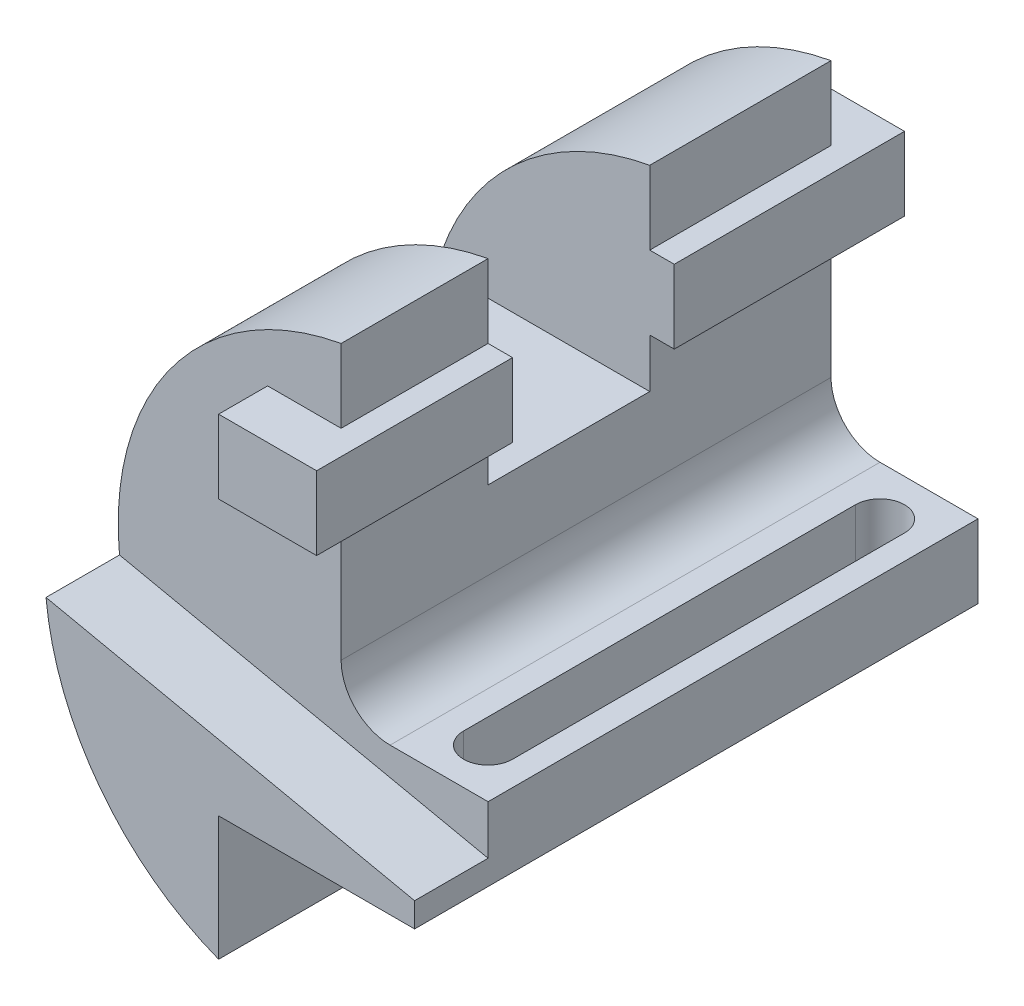
from build123d import *

# Parameters (mm, degrees)
BOSS_EXTRUDE1_DEPTH      = 115
CUT_EXTRUDE1_START       = -15
CUT_EXTRUDE1_DEPTH       = 15
BOSS_EXTRUDE2_DEPTH      = 10
BOSS_EXTRUDE2_DEPTH_BACK = 110
SKETCH3_W                = 20
SKETCH3_H                = 15
CUT_EXTRUDE2_DEPTH       = 148.83859442
CUT_EXTRUDE2_DEPTH_BACK  = 148.83859442
SKETCH4_W                = 33
SKETCH4_H                = 40
CUT_EXTRUDE3_DEPTH       = 153.581945197
CUT_EXTRUDE3_DEPTH_BACK  = 153.581945197
FILLET1_R                = 10


with BuildPart() as part:
    # Sketch1 → Boss-Extrude1 (new body)
    with BuildSketch(Plane.XY):
        with BuildLine():
            Line((0, 0), (0, 15))
            Line((0, 15), (-30, 15))
            Line((-30, 15), (-30, 81))
            ThreePointArc((-30, 81), (-75.256322222, 31.603413808), (-40, -25.362796982))
            Line((-40, -25.362796982), (-40, 0))
            Line((-40, 0), (0, 0))
        make_face()
    extrude(amount=BOSS_EXTRUDE1_DEPTH)

    # Sketch2 → Cut-Extrude1 (cut)
    with BuildSketch(Plane.XY.offset(115).offset(CUT_EXTRUDE1_START)):
        with BuildLine():
            Line((0, 5), (-75.235044142, 20.9917023))
            ThreePointArc((-75.235044142, 20.9917023), (-64.318751046, 59.816391467), (-30, 81))
            Line((-30, 81), (-30, 15))
            Line((-30, 15), (0, 15))
            Line((0, 15), (0, 5))
        make_face()
    extrude(amount=CUT_EXTRUDE1_DEPTH, mode=Mode.SUBTRACT)

    # Sketch3 → Boss-Extrude2 (add, two sides: drawn at the far end of the back side and taken through both)
    with BuildSketch(Plane(origin=(0, 0, 0), x_dir=(-1, 0, 0), z_dir=(0, 0, -1)).offset(-BOSS_EXTRUDE2_DEPTH_BACK)):
        with Locations((35, 58.5)):
            Rectangle(SKETCH3_W, SKETCH3_H)
    extrude(amount=BOSS_EXTRUDE2_DEPTH + BOSS_EXTRUDE2_DEPTH_BACK)

    # Sketch4 → Cut-Extrude2 (cut, two sides: drawn at the far end of the back side and taken through both)
    with BuildSketch(Plane(origin=(-30, 0, 0), x_dir=(0, 0, -1), z_dir=(1, 0, 0)).offset(-CUT_EXTRUDE2_DEPTH_BACK)):
        with Locations((-53.5, 61)):
            Rectangle(SKETCH4_W, SKETCH4_H)
    extrude(amount=CUT_EXTRUDE2_DEPTH + CUT_EXTRUDE2_DEPTH_BACK, mode=Mode.SUBTRACT)

    # Sketch5 → Cut-Extrude3 (cut, two sides: drawn at the far end of the back side and taken through both)
    with BuildSketch(Plane(origin=(0, 15, 0), x_dir=(1, 0, 0), z_dir=(0, 1, 0)).offset(-CUT_EXTRUDE3_DEPTH_BACK)):
        with BuildLine():
            Line((-5, -10), (-5, -90))
            ThreePointArc((-5, -90), (-10, -95), (-15, -90))
            Line((-15, -90), (-15, -10))
            ThreePointArc((-15, -10), (-10, -5), (-5, -10))
        make_face()
    extrude(amount=CUT_EXTRUDE3_DEPTH + CUT_EXTRUDE3_DEPTH_BACK, mode=Mode.SUBTRACT)

    # Fillet1
    fillet1_edges = [part.edges().sort_by_distance(p)[0] for p in [
        (-30, 15, 50),
    ]]
    fillet(fillet1_edges, radius=FILLET1_R)


solid = part.part
